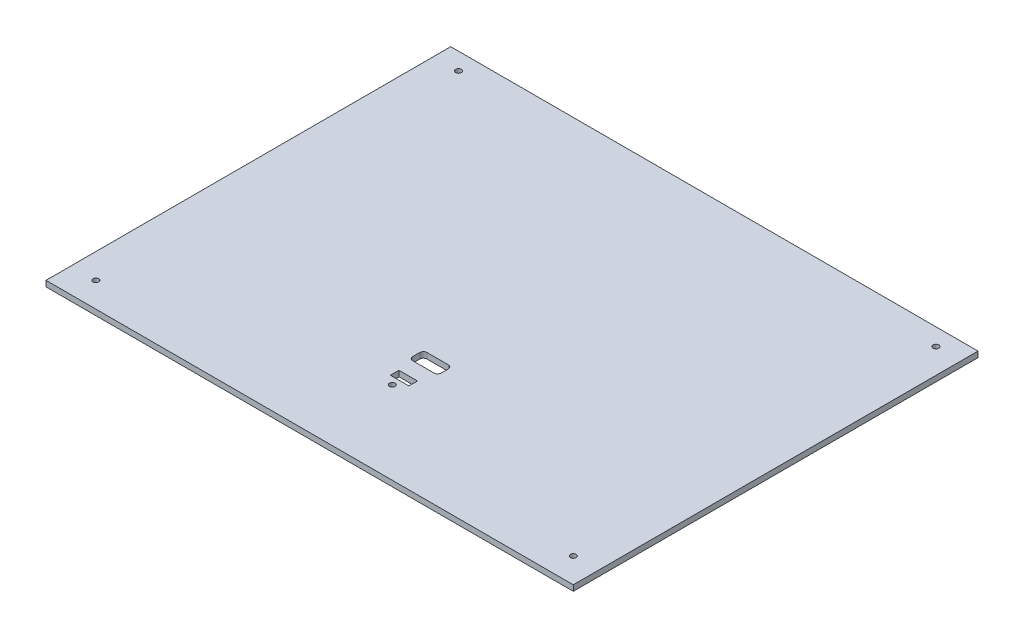
from build123d import *

# Parameters (mm, degrees)
SKETCH1_W           = 370
SKETCH1_H           = 284
BOSS_EXTRUDE1_DEPTH = 4
SKETCH3_R           = 2
SKETCH3_W           = 13
SKETCH3_H           = 6
SKETCH3_W_2         = 20
SKETCH3_H_2         = 10
CUT_EXTRUDE1_DEPTH  = 4
FILLET1_R           = 2.5


with BuildPart() as part:
    # Sketch1 → Boss-Extrude1 (new body)
    with BuildSketch(Plane(origin=(0, 0, 0), x_dir=(1, 0, 0), z_dir=(0, 1, 0))):
        Rectangle(SKETCH1_W, SKETCH1_H)
    extrude(amount=BOSS_EXTRUDE1_DEPTH)

    # Sketch3 → Cut-Extrude1 (cut)
    with BuildSketch(Plane(origin=(0, 4, 0), x_dir=(1, 0, 0), z_dir=(0, 1, 0))):
        with Locations(Location((-167.5, 130, 0), (0, 0, 270))):
            Circle(SKETCH3_R)
        with Locations(Location((-167.5, -124.5, 0), (0, 0, 270))):
            Circle(SKETCH3_R)
        with Locations(Location((167.5, -124.5, 0), (0, 0, 270))):
            Circle(SKETCH3_R)
        with Locations(Location((167.5, 130, 0), (0, 0, 270))):
            Circle(SKETCH3_R)
        with Locations(Location((0, -84, 0), (0, 0, 270))):
            Circle(SKETCH3_R)
        with Locations((0, -75.85)):
            Rectangle(SKETCH3_W, SKETCH3_H)
        with Locations((0, -57.187381091)):
            Rectangle(SKETCH3_W_2, SKETCH3_H_2)
    extrude(amount=-CUT_EXTRUDE1_DEPTH, mode=Mode.SUBTRACT)

    # Fillet1
    fillet1_edges = [part.edges().sort_by_distance(p)[0] for p in [
        (-10, 2, 62.187381091),
        (-10, 2, 52.187381091),
        (10, 2, 52.187381091),
        (10, 2, 62.187381091),
    ]]
    fillet(fillet1_edges, radius=FILLET1_R)


solid = part.part
